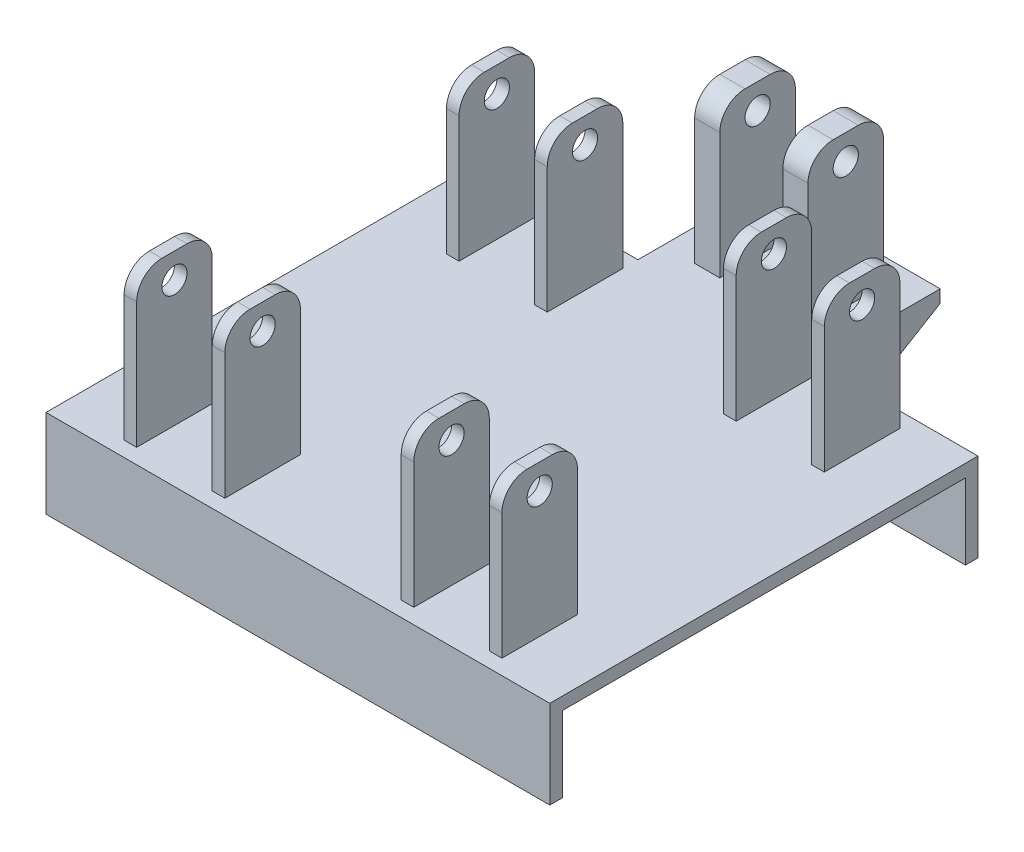
from build123d import *

# Parameters (mm, degrees)
SKETCH2_W              = 200
SKETCH2_H              = 160
BOSS_EXTRUDE1_DEPTH    = 5
SKETCH3_W              = 5
SKETCH3_H              = 30
BOSS_EXTRUDE2_DEPTH    = 60
CUT_EXTRUDE1_REACH     = 171.853
SKETCH4_R              = 5
FILLET1_R              = 10
LPATTERN1_COUNT        = 2
LPATTERN1_PITCH        = 110
LPATTERN1_COUNT_DIR2   = 2
LPATTERN1_PITCH_DIR2   = 127.98756405
FILLET1_OF_LPATTERN1_R = 10
SKETCH6_W              = 200
SKETCH6_H              = 35
BOSS_EXTRUDE3_DEPTH    = 5
SKETCH7_W              = 70
SKETCH7_H              = 5
BOSS_EXTRUDE8_DEPTH    = 50
SKETCH9_W              = 10
SKETCH9_H              = 30
BOSS_EXTRUDE9_DEPTH    = 60
FILLET2_R              = 10
CUT_EXTRUDE2_REACH     = 195.536
SKETCH11_R             = 5
RIB4_REACH             = 203.68
SKETCH14_WALL_W        = 463.67039955
SKETCH14_WALL_H        = 10


with BuildPart() as part:
    # Sketch2 → Boss-Extrude1 (new body)
    with BuildSketch(Plane(origin=(0, 0, 0), x_dir=(1, 0, 0), z_dir=(0, 1, 0))):
        Rectangle(SKETCH2_W, SKETCH2_H)
    extrude(amount=BOSS_EXTRUDE1_DEPTH)

    # Sketch3 → Boss-Extrude2 (add)
    with BuildSketch(Plane(origin=(0, 5, 0), x_dir=(1, 0, 0), z_dir=(0, 1, 0))):
        with Locations((-72.5, 63.98756405)):
            Rectangle(SKETCH3_W, SKETCH3_H)
        with Locations((-37.5, 63.98756405)):
            Rectangle(SKETCH3_W, SKETCH3_H)
    boss_extrude2 = extrude(amount=BOSS_EXTRUDE2_DEPTH)

    # Cut-Extrude1: up to this face of the body (flat: up to its plane)
    cut_extrude1_end = Plane(part.part.faces().sort_by_distance((-75, 35, -63.98756405))[0])
    # Sketch4 → Cut-Extrude1 (cut, up to the picked face)
    with BuildSketch(Plane(origin=(-35, 0, 0), x_dir=(0, 0, -1), z_dir=(1, 0, 0)), mode=Mode.PRIVATE) as cut_extrude1_sk1:
        with Locations((63.98756405, 55)):
            Circle(SKETCH4_R)
    cut_extrude1_tool1 = split(extrude(cut_extrude1_sk1.sketch, amount=-CUT_EXTRUDE1_REACH, mode=Mode.PRIVATE), bisect_by=cut_extrude1_end, keep=Keep.BOTH, mode=Mode.PRIVATE)
    cut_extrude1 = cut_extrude1_tool1.solids().sort_by(Axis((-35, 55, -63.987564), (-1, 0, 0)))[0]
    add(cut_extrude1, mode=Mode.SUBTRACT)

    # Fillet1
    fillet1_edges = [part.edges().sort_by_distance(p)[0] for p in [
        (-72.5, 65, -78.98756405),
        (-72.5, 65, -48.98756405),
        (-37.5, 65, -78.98756405),
        (-37.5, 65, -48.98756405),
    ]]
    fillet(fillet1_edges, radius=FILLET1_R)

    # LPattern1: Boss-Extrude2, Cut-Extrude1 2 × 2
    with Locations(*[(i * LPATTERN1_PITCH, 0, j * LPATTERN1_PITCH_DIR2) for i in range(LPATTERN1_COUNT) for j in range(LPATTERN1_COUNT_DIR2) if (i, j) != (0, 0)]):
        add(boss_extrude2)
        add(cut_extrude1, mode=Mode.SUBTRACT)

    # Fillet1 of LPattern1
    fillet1_of_lpattern1_edges = [part.edges().sort_by_distance(p)[0] for p in [
        (-72.5, 65, 49),
        (-72.5, 65, 79),
        (-37.5, 65, 49),
        (-37.5, 65, 79),
        (37.5, 65, -78.98756405),
        (37.5, 65, -48.98756405),
        (72.5, 65, -78.98756405),
        (72.5, 65, -48.98756405),
        (37.5, 65, 49),
        (37.5, 65, 79),
        (72.5, 65, 49),
        (72.5, 65, 79),
    ]]
    fillet(fillet1_of_lpattern1_edges, radius=FILLET1_OF_LPATTERN1_R)

    # Sketch6 → Boss-Extrude3 (add)
    with BuildSketch(Plane(origin=(0, 0, -80), x_dir=(-1, 0, 0), z_dir=(0, 0, -1))):
        with Locations((0, -12.5)):
            Rectangle(SKETCH6_W, SKETCH6_H)
    boss_extrude3 = extrude(amount=BOSS_EXTRUDE3_DEPTH)

    # Mirror8: Boss-Extrude3 across plane
    add(boss_extrude3.mirror(Plane.XY))

    # Sketch7 → Boss-Extrude8 (add)
    with BuildSketch(Plane(origin=(0, 0, -85), x_dir=(-1, 0, 0), z_dir=(0, 0, -1))):
        with Locations((0, 2.5)):
            Rectangle(SKETCH7_W, SKETCH7_H)
    extrude(amount=BOSS_EXTRUDE8_DEPTH)

    # Sketch9 → Boss-Extrude9 (add)
    with BuildSketch(Plane(origin=(0, 5, 0), x_dir=(1, 0, 0), z_dir=(0, 1, 0))):
        with Locations((-17.5, 110)):
            Rectangle(SKETCH9_W, SKETCH9_H)
        with Locations((17.5, 110)):
            Rectangle(SKETCH9_W, SKETCH9_H)
    extrude(amount=BOSS_EXTRUDE9_DEPTH)

    # Fillet2
    fillet2_edges = [part.edges().sort_by_distance(p)[0] for p in [
        (-17.5, 65, -95),
        (-17.5, 65, -125),
        (17.5, 65, -95),
        (17.5, 65, -125),
    ]]
    fillet(fillet2_edges, radius=FILLET2_R)

    # Cut-Extrude2: up to this face of the body (flat: up to its plane)
    cut_extrude2_end = Plane(part.part.faces().sort_by_distance((-22.5, 34.321749192, -110))[0])
    # Sketch11 → Cut-Extrude2 (cut, up to the picked face)
    with BuildSketch(Plane(origin=(22.5, 0, 0), x_dir=(0, 0, -1), z_dir=(1, 0, 0)), mode=Mode.PRIVATE) as cut_extrude2_sk1:
        with Locations((110, 55)):
            Circle(SKETCH11_R)
    cut_extrude2_tool1 = split(extrude(cut_extrude2_sk1.sketch, amount=-CUT_EXTRUDE2_REACH, mode=Mode.PRIVATE), bisect_by=cut_extrude2_end, keep=Keep.BOTH, mode=Mode.PRIVATE)
    add(cut_extrude2_tool1.solids().sort_by(Axis((22.5, 55, -110), (-1, 0, 0)))[0], mode=Mode.SUBTRACT)

    # Sketch14 wall → Rib4 (add, up to next)
    with BuildSketch(Plane(origin=(35, -15, -110), x_dir=(0, -0.514495755428, 0.857492925713), z_dir=(0, -0.857492925713, -0.514495755428)), mode=Mode.PRIVATE) as rib4_sk1:
        with Locations((0, 5)):
            Rectangle(SKETCH14_WALL_W, SKETCH14_WALL_H)
    rib4_tool1 = extrude(rib4_sk1.sketch, amount=-RIB4_REACH, mode=Mode.PRIVATE) - part.part
    rib4 = rib4_tool1.solids().sort_by_distance((35, -15, -110))[0]
    add(rib4)

    # Mirror1: Rib4 across plane
    add(rib4.mirror(Plane(origin=(0, 0, 0), x_dir=(0, 0, 1), z_dir=(1, 0, 0))))


solid = part.part
